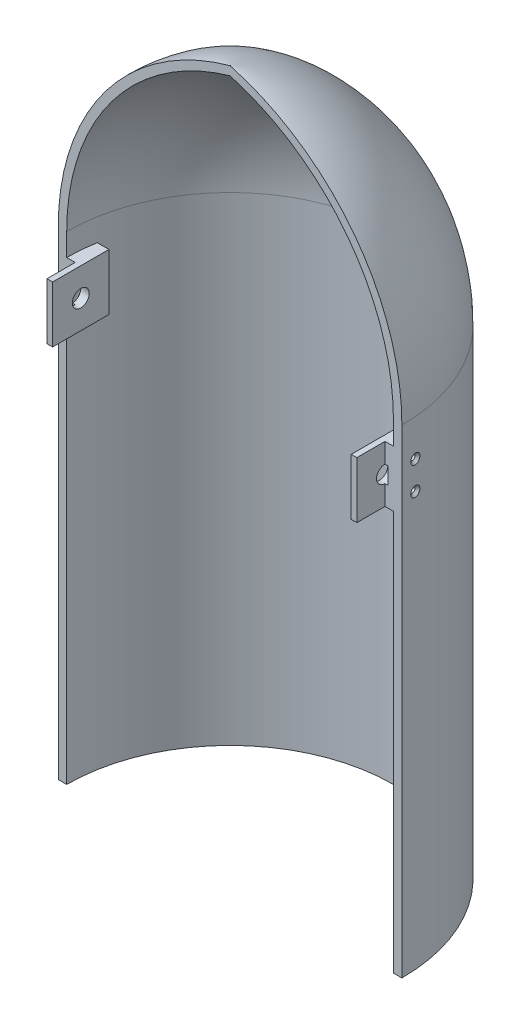
from build123d import *

# Parameters (mm, degrees)
REVOLVE1_ANGLE                                       = 180
BOSS_EXTRUDE1_DEPTH                                  = 10
BOSS_EXTRUDE1_DEPTH_BACK                             = 10
SKETCH2_W                                            = 5
SKETCH2_H                                            = 20
CUT_EXTRUDE1_DEPTH                                   = 10
CSK_FOR_M1_6_COUNTERSUNK_FLAT_HEAD_SCREW_D           = 1.8
CSK_FOR_M1_6_COUNTERSUNK_FLAT_HEAD_SCREW_DEPTH       = 5
CSK_FOR_M1_6_COUNTERSUNK_FLAT_HEAD_SCREW_CSINK_D     = 3.6
CSK_FOR_M1_6_COUNTERSUNK_FLAT_HEAD_SCREW_CSINK_ANGLE = 90
CSK_FOR_M1_6_COUNTERSUNK_FLAT_HEAD_SCREW_TIP         = 0.540774557
CSK_FOR_M1_6_COUNTERSUNK_FLAT_HEAD_S_2_D             = 1.8
CSK_FOR_M1_6_COUNTERSUNK_FLAT_HEAD_S_2_DEPTH         = 5
CSK_FOR_M1_6_COUNTERSUNK_FLAT_HEAD_S_2_CSINK_D       = 3.6
CSK_FOR_M1_6_COUNTERSUNK_FLAT_HEAD_S_2_CSINK_ANGLE   = 90
CSK_FOR_M1_6_COUNTERSUNK_FLAT_HEAD_S_2_TIP           = 0.540774557
CSK_FOR_M1_6_COUNTERSUNK_FLAT_HEAD_S_3_D             = 1.8
CSK_FOR_M1_6_COUNTERSUNK_FLAT_HEAD_S_3_DEPTH         = 5
CSK_FOR_M1_6_COUNTERSUNK_FLAT_HEAD_S_3_CSINK_D       = 3.6
CSK_FOR_M1_6_COUNTERSUNK_FLAT_HEAD_S_3_CSINK_ANGLE   = 90
CSK_FOR_M1_6_COUNTERSUNK_FLAT_HEAD_S_3_TIP           = 0.540774557
SKETCH9_R                                            = 3
CUT_EXTRUDE2_DEPTH                                   = 3
CUT_EXTRUDE3_START                                   = -3
SKETCH10_R                                           = 3
CUT_EXTRUDE3_DEPTH                                   = 3


with BuildPart() as part:
    # Sketch1 → Revolve1 (revolve)
    with BuildSketch(Plane.XY):
        with BuildLine():
            Line((61, 170), (61, 0))
            Line((61, 0), (58, 0))
            Line((58, 0), (58, 170))
            ThreePointArc((58, 170), (41.873834296, 218.154039035), (0, 246.884627213))
            Line((0, 246.884627213), (0, 250))
            ThreePointArc((0, 250), (44.010282534, 220.301590432), (61, 170))
        make_face()
    revolve(axis=Axis((0, 0, 0), (0, 1, 0)), revolution_arc=REVOLVE1_ANGLE)

    # Sketch2 → Boss-Extrude1 (add, two sides: drawn at the far end of the back side and taken through both)
    with BuildSketch(Plane.XY.offset(-BOSS_EXTRUDE1_DEPTH_BACK)):
        with Locations((55.5, 152)):
            Rectangle(SKETCH2_W, SKETCH2_H)
        with Locations((-55.5, 152)):
            Rectangle(SKETCH2_W, SKETCH2_H)
    extrude(amount=BOSS_EXTRUDE1_DEPTH + BOSS_EXTRUDE1_DEPTH_BACK)

    # Sketch4 → Cut-Extrude1 (cut)
    with BuildSketch(Plane.XY.offset(10)):
        Polygon((-55, 162), (-56, 162), (-58, 162), (-58, 142), (-56, 142), (-55, 142), align=None)
        Polygon((55, 142), (56, 142), (58, 142), (58, 162), (56, 162), (55, 162), align=None)
    extrude(amount=-CUT_EXTRUDE1_DEPTH, mode=Mode.SUBTRACT)

    # CSK for M1.6 Countersunk Flat Head Screw2
    with Locations(Plane(origin=(60.795081967, 157.001615154, -4.995799095), x_dir=(0.081898345823, 0, 0.996640687987), z_dir=(0.996640687987, 0, -0.081898345823))):
        with Locations((0, 0)):
            CounterSinkHole(CSK_FOR_M1_6_COUNTERSUNK_FLAT_HEAD_SCREW_D / 2, CSK_FOR_M1_6_COUNTERSUNK_FLAT_HEAD_SCREW_CSINK_D / 2, depth=CSK_FOR_M1_6_COUNTERSUNK_FLAT_HEAD_SCREW_DEPTH, counter_sink_angle=CSK_FOR_M1_6_COUNTERSUNK_FLAT_HEAD_SCREW_CSINK_ANGLE)
            with Locations((0, 0, -(CSK_FOR_M1_6_COUNTERSUNK_FLAT_HEAD_SCREW_DEPTH + CSK_FOR_M1_6_COUNTERSUNK_FLAT_HEAD_SCREW_TIP / 2))):  # 118° drill point
                Cone(0, CSK_FOR_M1_6_COUNTERSUNK_FLAT_HEAD_SCREW_D / 2, CSK_FOR_M1_6_COUNTERSUNK_FLAT_HEAD_SCREW_TIP, mode=Mode.SUBTRACT)

    # CSK for M1.6 Countersunk Flat Head S 2
    with Locations(Plane(origin=(60.795081967, 147.001615154, -4.995799095), x_dir=(0.081897976852, 0, 0.996640718307), z_dir=(0.996640718307, 0, -0.081897976852))):
        with Locations((0, 0)):
            CounterSinkHole(CSK_FOR_M1_6_COUNTERSUNK_FLAT_HEAD_S_2_D / 2, CSK_FOR_M1_6_COUNTERSUNK_FLAT_HEAD_S_2_CSINK_D / 2, depth=CSK_FOR_M1_6_COUNTERSUNK_FLAT_HEAD_S_2_DEPTH, counter_sink_angle=CSK_FOR_M1_6_COUNTERSUNK_FLAT_HEAD_S_2_CSINK_ANGLE)
            with Locations((0, 0, -(CSK_FOR_M1_6_COUNTERSUNK_FLAT_HEAD_S_2_DEPTH + CSK_FOR_M1_6_COUNTERSUNK_FLAT_HEAD_S_2_TIP / 2))):  # 118° drill point
                Cone(0, CSK_FOR_M1_6_COUNTERSUNK_FLAT_HEAD_S_2_D / 2, CSK_FOR_M1_6_COUNTERSUNK_FLAT_HEAD_S_2_TIP, mode=Mode.SUBTRACT)

    # CSK for M1.6 Countersunk Flat Head S 3
    with Locations(Plane(origin=(-60.795081967, 147.001615154, -4.995799095), x_dir=(0.081897976852, 0, -0.996640718307), z_dir=(-0.996640718307, 0, -0.081897976852))):
        with Locations((0, 0), (0, -10)):
            CounterSinkHole(CSK_FOR_M1_6_COUNTERSUNK_FLAT_HEAD_S_3_D / 2, CSK_FOR_M1_6_COUNTERSUNK_FLAT_HEAD_S_3_CSINK_D / 2, depth=CSK_FOR_M1_6_COUNTERSUNK_FLAT_HEAD_S_3_DEPTH, counter_sink_angle=CSK_FOR_M1_6_COUNTERSUNK_FLAT_HEAD_S_3_CSINK_ANGLE)
            with Locations((0, 0, -(CSK_FOR_M1_6_COUNTERSUNK_FLAT_HEAD_S_3_DEPTH + CSK_FOR_M1_6_COUNTERSUNK_FLAT_HEAD_S_3_TIP / 2))):  # 118° drill point
                Cone(0, CSK_FOR_M1_6_COUNTERSUNK_FLAT_HEAD_S_3_D / 2, CSK_FOR_M1_6_COUNTERSUNK_FLAT_HEAD_S_3_TIP, mode=Mode.SUBTRACT)

    # Sketch9 → Cut-Extrude2 (cut)
    with BuildSketch(Plane(origin=(-53, 0, 0), x_dir=(0, 0, -1), z_dir=(1, 0, 0))):
        with Locations((0, 152)):
            Circle(SKETCH9_R)
    extrude(amount=-CUT_EXTRUDE2_DEPTH, mode=Mode.SUBTRACT)

    # Sketch10 → Cut-Extrude3 (cut)
    with BuildSketch(Plane.ZY.offset(-53).offset(CUT_EXTRUDE3_START)):
        with Locations((0, 152)):
            Circle(SKETCH10_R)
    extrude(amount=CUT_EXTRUDE3_DEPTH, mode=Mode.SUBTRACT)


solid = part.part
